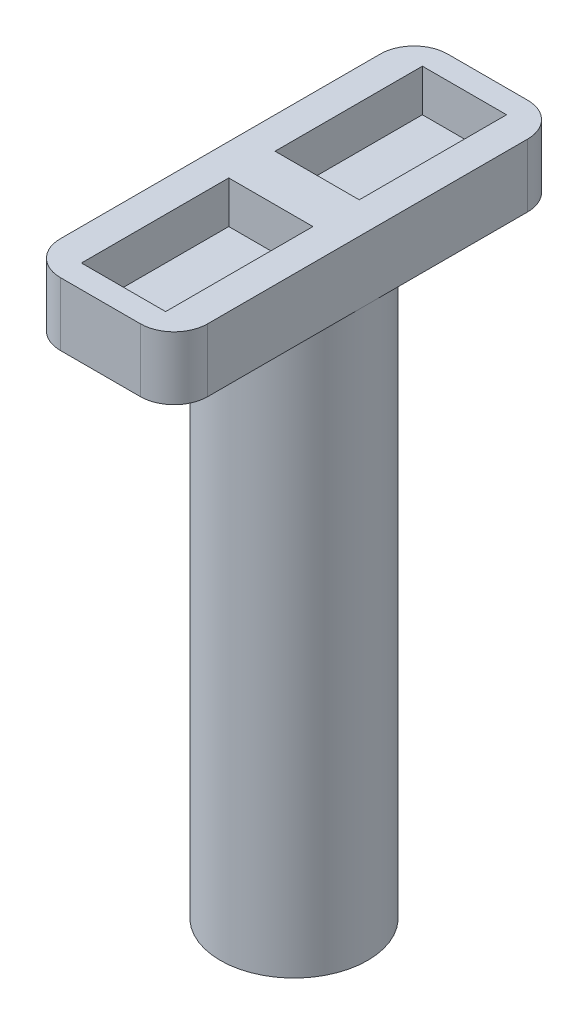
from build123d import *

# Parameters (mm, degrees)
SKETCH1_R           = 17.5
BOSS_EXTRUDE1_DEPTH = 150
SKETCH2_W           = 35
SKETCH2_H           = 15
BOSS_EXTRUDE2_DEPTH = 46
SKETCH3_W           = 20
SKETCH3_H           = 35
CUT_EXTRUDE1_DEPTH  = 10
FILLET1_R           = 8


with BuildPart() as part:
    # Sketch1 → Boss-Extrude1 (new body)
    with BuildSketch(Plane(origin=(0, 0, 0), x_dir=(1, 0, 0), z_dir=(0, 1, 0))):
        with Locations(Location((0, 0, 0), (0, 0, 270))):
            Circle(SKETCH1_R)
    extrude(amount=BOSS_EXTRUDE1_DEPTH)

    # Sketch2 → Boss-Extrude2 (add, symmetric)
    with BuildSketch(Plane.XY):
        with Locations((0, 142.5)):
            Rectangle(SKETCH2_W, SKETCH2_H)
    extrude(amount=BOSS_EXTRUDE2_DEPTH, both=True)

    # Sketch3 → Cut-Extrude1 (cut)
    with BuildSketch(Plane(origin=(0, 150, 0), x_dir=(1, 0, 0), z_dir=(0, 1, 0))):
        with Locations((0, 23)):
            Rectangle(SKETCH3_W, SKETCH3_H)
        with Locations((0, -23)):
            Rectangle(SKETCH3_W, SKETCH3_H)
    extrude(amount=-CUT_EXTRUDE1_DEPTH, mode=Mode.SUBTRACT)

    # Fillet1
    fillet1_edges = [part.edges().sort_by_distance(p)[0] for p in [
        (-17.5, 142.5, 46),
        (17.5, 142.5, 46),
        (17.5, 142.5, -46),
        (-17.5, 142.5, -46),
    ]]
    fillet(fillet1_edges, radius=FILLET1_R)


solid = part.part
